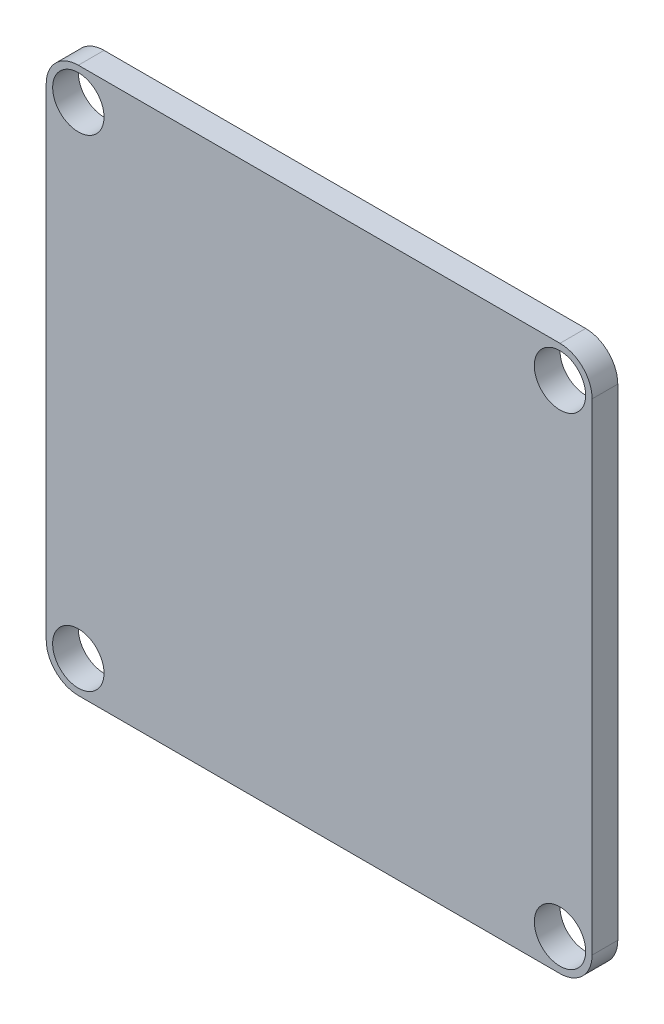
from build123d import *

# Parameters (mm, degrees)
SKETCH1_R           = 1.6
BOSS_EXTRUDE1_DEPTH = 1.6


with BuildPart() as part:
    # Sketch1 → Boss-Extrude1 (new body)
    with BuildSketch(Plane.XY):
        with BuildLine():
            Line((-13.235657624, 13.611622239), (16.764342376, 13.611622239))
            ThreePointArc((16.764342376, 13.611622239), (18.178555938, 13.025835801), (18.764342376, 11.611622239))
            Line((18.764342376, 11.611622239), (18.764342376, -18.388377761))
            ThreePointArc((18.764342376, -18.388377761), (18.178555938, -19.802591324), (16.764342376, -20.388377761))
            Line((16.764342376, -20.388377761), (-13.235657624, -20.388377761))
            ThreePointArc((-13.235657624, -20.388377761), (-14.649871187, -19.802591324), (-15.235657624, -18.388377761))
            Line((-15.235657624, -18.388377761), (-15.235657624, 11.611622239))
            ThreePointArc((-15.235657624, 11.611622239), (-14.649871187, 13.025835801), (-13.235657624, 13.611622239))
        make_face()
        with Locations((16.764342376, 11.611622239)):
            Circle(SKETCH1_R, mode=Mode.SUBTRACT)
        with Locations(Location((16.764342376, -18.388377761, 0), (0, 0, 180))):
            Circle(SKETCH1_R, mode=Mode.SUBTRACT)
        with Locations(Location((-13.235657624, 11.611622239, 0), (0, 0, 180))):
            Circle(SKETCH1_R, mode=Mode.SUBTRACT)
        with Locations((-13.235657624, -18.388377761)):
            Circle(SKETCH1_R, mode=Mode.SUBTRACT)
    extrude(amount=BOSS_EXTRUDE1_DEPTH)


solid = part.part
